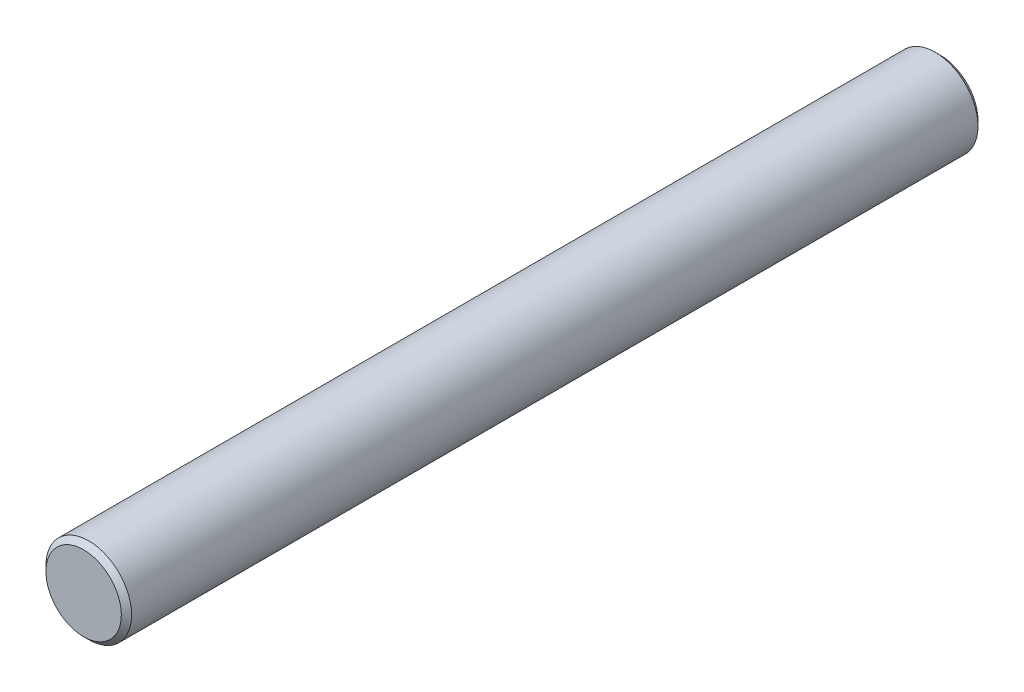
from build123d import *

# Parameters (mm, degrees)
SKETCH_1_R      = 2.5
EXTRUDE_1_DEPTH = 50
CHAMFER_1_SIZE  = 0.3


with BuildPart() as part:
    # Эскиз1 → Бобышка-Вытянуть1 (new body)
    with BuildSketch(Plane.XY):
        Circle(SKETCH_1_R)
    extrude(amount=EXTRUDE_1_DEPTH)

    # Фаска1
    chamfer_1_edges = [part.edges().sort_by_distance(p)[0] for p in [
        (-2.5, 0, 0),
        (-2.5, 0, 50),
    ]]
    chamfer(chamfer_1_edges, length=CHAMFER_1_SIZE)


solid = part.part
